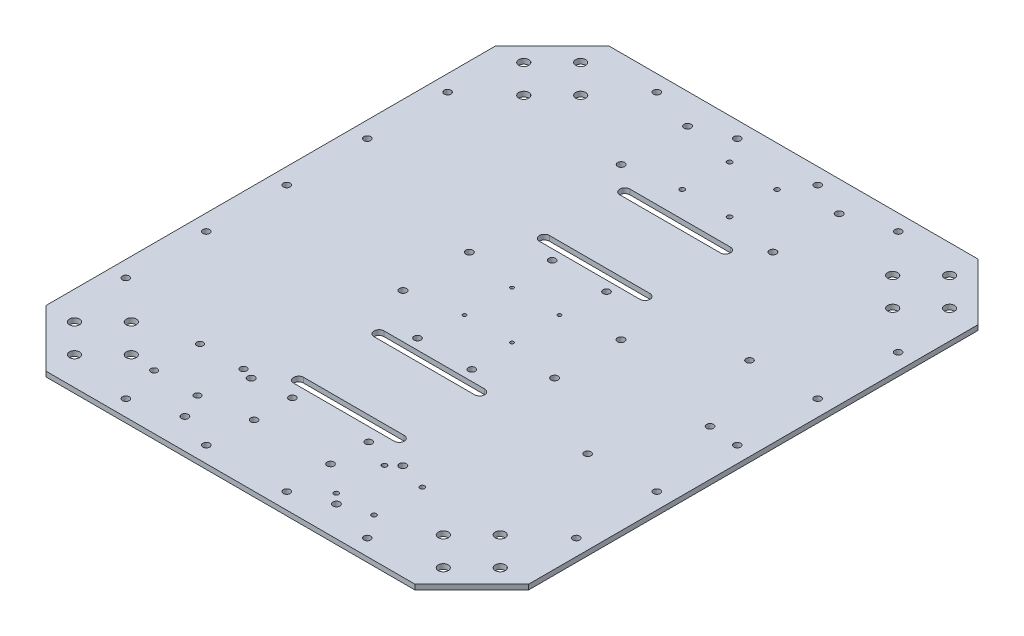
from build123d import *

# Parameters (mm, degrees)
SKETCH1_R               = 2.2225
BOSS_EXTRUDE1_DEPTH     = 3.175
SKETCH2_R               = 2.159
CUT_EXTRUDE1_DEPTH      = 297.247830215
CUT_EXTRUDE2_DEPTH      = 297.247830215
SKETCH7_R               = 1.524
CUT_EXTRUDE3_DEPTH      = 297.247830215
CUT_EXTRUDE4_DEPTH      = 297.247830215
CUT_EXTRUDE4_DEPTH_BACK = 297.247830215
SKETCH8_R               = 1.524
SKETCH9_R               = 2.032
CUT_EXTRUDE5_DEPTH      = 297.247830215
SKETCH10_R              = 2.159
CUT_EXTRUDE6_DEPTH      = 297.247830215
SKETCH13_R              = 1.1
CUT_EXTRUDE8_DEPTH      = 297.247830215
SKETCH14_R              = 3.175
CUT_EXTRUDE9_DEPTH      = 297.247830215
SKETCH15_R              = 2.159
CUT_EXTRUDE10_DEPTH     = 297.247830215
SKETCH16_R              = 2.159
CUT_EXTRUDE11_DEPTH     = 297.247830215


with BuildPart() as part:
    # Sketch1 → Boss-Extrude1 (new body)
    with BuildSketch(Plane(origin=(0, 0, 0), x_dir=(1, 0, 0), z_dir=(0, 1, 0))):
        Polygon((-85.365028143, 123.058976948), (-121.286052627, 87.137952464), (-121.286052627, -196.619998567), (-85.365028143, -232.541023052), (147.592922888, -232.541023052), (183.513947373, -196.619998567), (183.513947373, 87.137952464), (147.592922888, 123.058976948), align=None)
        with Locations(Location((-16.765052627, -213.491023052, 0), (0, 0, 270))):
            Circle(SKETCH1_R, mode=Mode.SUBTRACT)
        with Locations(Location((-16.765052627, -171.581023052, 0), (0, 0, 270))):
            Circle(SKETCH1_R, mode=Mode.SUBTRACT)
        with Locations(Location((-16.765052627, -75.696023052, 0), (0, 0, 270))):
            Circle(SKETCH1_R, mode=Mode.SUBTRACT)
        with Locations(Location((78.992947373, -213.491023052, 0), (0, 0, 270))):
            Circle(SKETCH1_R, mode=Mode.SUBTRACT)
        with Locations(Location((78.992947373, -171.581023052, 0), (0, 0, 270))):
            Circle(SKETCH1_R, mode=Mode.SUBTRACT)
        with Locations(Location((78.992947373, -75.696023052, 0), (0, 0, 270))):
            Circle(SKETCH1_R, mode=Mode.SUBTRACT)
        with Locations(Location((-16.765052627, -33.786023052, 0), (0, 0, 270))):
            Circle(SKETCH1_R, mode=Mode.SUBTRACT)
        with Locations(Location((-16.765052627, 62.098976948, 0), (0, 0, 270))):
            Circle(SKETCH1_R, mode=Mode.SUBTRACT)
        with Locations(Location((-16.765052627, 104.008976948, 0), (0, 0, 270))):
            Circle(SKETCH1_R, mode=Mode.SUBTRACT)
        with Locations(Location((78.992947373, -33.786023052, 0), (0, 0, 270))):
            Circle(SKETCH1_R, mode=Mode.SUBTRACT)
        with Locations(Location((78.992947373, 62.098976948, 0), (0, 0, 270))):
            Circle(SKETCH1_R, mode=Mode.SUBTRACT)
        with Locations(Location((78.992947373, 104.008976948, 0), (0, 0, 270))):
            Circle(SKETCH1_R, mode=Mode.SUBTRACT)
    extrude(amount=BOSS_EXTRUDE1_DEPTH)

    # Sketch2 → Cut-Extrude1 (cut, through all)
    with BuildSketch(Plane(origin=(0, 3.175, 0), x_dir=(1, 0, 0), z_dir=(0, 1, 0))):
        with Locations(Location((13.841947373, -12.069023052, 0), (0, 0, 270))):
            Circle(SKETCH2_R)
        with Locations(Location((48.131947373, -12.069023052, 0), (0, 0, 270))):
            Circle(SKETCH2_R)
        with Locations(Location((13.841947373, -97.159023052, 0), (0, 0, 270))):
            Circle(SKETCH2_R)
        with Locations(Location((48.131947373, -97.159023052, 0), (0, 0, 270))):
            Circle(SKETCH2_R)
    extrude(amount=-CUT_EXTRUDE1_DEPTH, mode=Mode.SUBTRACT)

    # Sketch4 → Cut-Extrude2 (cut, through all)
    with BuildSketch(Plane(origin=(0, 3.175, 0), x_dir=(1, 0, 0), z_dir=(0, 1, 0))):
        with BuildLine():
            Line((-0.636052627, 51.430976948), (62.863947373, 51.430976948))
            ThreePointArc((62.863947373, 51.430976948), (66.038947373, 48.255976948), (62.863947373, 45.080976948))
            Line((62.863947373, 45.080976948), (-0.636052627, 45.080976948))
            ThreePointArc((-0.636052627, 45.080976948), (-3.811052627, 48.255976948), (-0.636052627, 51.430976948))
        make_face()
        with BuildLine():
            Line((-0.636052627, 0.630976948), (62.863947373, 0.630976948))
            ThreePointArc((62.863947373, 0.630976948), (66.038947373, -2.544023052), (62.863947373, -5.719023052))
            Line((62.863947373, -5.719023052), (-0.636052627, -5.719023052))
            ThreePointArc((-0.636052627, -5.719023052), (-3.811052627, -2.544023052), (-0.636052627, 0.630976948))
        make_face()
        with BuildLine():
            Line((-0.636052627, -110.113023052), (62.863947373, -110.113023052))
            ThreePointArc((62.863947373, -110.113023052), (66.038947373, -106.938023052), (62.863947373, -103.763023052))
            Line((62.863947373, -103.763023052), (-0.636052627, -103.763023052))
            ThreePointArc((-0.636052627, -103.763023052), (-3.811052627, -106.938023052), (-0.636052627, -110.113023052))
        make_face()
        with BuildLine():
            Line((-0.636052627, -160.913023052), (62.863947373, -160.913023052))
            ThreePointArc((62.863947373, -160.913023052), (66.038947373, -157.738023052), (62.863947373, -154.563023052))
            Line((62.863947373, -154.563023052), (-0.636052627, -154.563023052))
            ThreePointArc((-0.636052627, -154.563023052), (-3.811052627, -157.738023052), (-0.636052627, -160.913023052))
        make_face()
    extrude(amount=-CUT_EXTRUDE2_DEPTH, mode=Mode.SUBTRACT)

    # Sketch7 → Cut-Extrude3 (cut, through all)
    with BuildSketch(Plane(origin=(0, 3.175, 0), x_dir=(1, 0, 0), z_dir=(0, 1, 0))):
        with Locations(Location((16.127947373, 67.686976948, 0), (0, 0, 270))):
            Circle(SKETCH7_R)
        with Locations(Location((46.099947373, 67.686976948, 0), (0, 0, 270))):
            Circle(SKETCH7_R)
        with Locations(Location((16.127947373, 97.658976948, 0), (0, 0, 270))):
            Circle(SKETCH7_R)
        with Locations(Location((46.099947373, 97.658976948, 0), (0, 0, 270))):
            Circle(SKETCH7_R)
    extrude(amount=-CUT_EXTRUDE3_DEPTH, mode=Mode.SUBTRACT)

    # Sketch8 → Cut-Extrude4 (cut, two sides: drawn at the far end of the back side and taken through both)
    with BuildSketch(Plane(origin=(0, 3.175, 0), x_dir=(1, 0, 0), z_dir=(0, 1, 0)).offset(-CUT_EXTRUDE4_DEPTH_BACK)):
        with Locations(Location((73.023947373, -207.649023052, 0), (0, 0, 270))):
            Circle(SKETCH8_R)
        with Locations(Location((73.023947373, -177.169023052, 0), (0, 0, 270))):
            Circle(SKETCH8_R)
        with Locations(Location((96.899947373, -207.649023052, 0), (0, 0, 270))):
            Circle(SKETCH8_R)
        with Locations(Location((96.899947373, -177.169023052, 0), (0, 0, 270))):
            Circle(SKETCH8_R)
    extrude(amount=CUT_EXTRUDE4_DEPTH + CUT_EXTRUDE4_DEPTH_BACK, mode=Mode.SUBTRACT)

    # Sketch9 → Cut-Extrude5 (cut, through all)
    with BuildSketch(Plane(origin=(0, 0, 0), x_dir=(-1, 0, 0), z_dir=(0, -1, 0))):
        with Locations(Location((51.649412627, -197.969083052, 0), (0, 0, 90))):
            Circle(SKETCH9_R)
        with Locations(Location((24.217412627, -197.969083052, 0), (0, 0, 90))):
            Circle(SKETCH9_R)
        with Locations(Location((51.649412627, -169.013083052, 0), (0, 0, 90))):
            Circle(SKETCH9_R)
        with Locations(Location((24.217412627, -169.013083052, 0), (0, 0, 90))):
            Circle(SKETCH9_R)
    extrude(amount=-CUT_EXTRUDE5_DEPTH, mode=Mode.SUBTRACT)

    # Sketch10 → Cut-Extrude6 (cut, through all)
    with BuildSketch(Plane.XZ):
        with Locations(Location((6.983947373, 193.475823052, 0), (0, 0, 270))):
            Circle(SKETCH10_R)
        with Locations(Location((55.243947373, 193.475823052, 0), (0, 0, 270))):
            Circle(SKETCH10_R)
        with Locations(Location((6.983947373, 169.345823052, 0), (0, 0, 270))):
            Circle(SKETCH10_R)
        with Locations(Location((55.243947373, 169.345823052, 0), (0, 0, 270))):
            Circle(SKETCH10_R)
    extrude(amount=-CUT_EXTRUDE6_DEPTH, mode=Mode.SUBTRACT)

    # Sketch13 → Cut-Extrude8 (cut, through all)
    with BuildSketch(Plane.XZ):
        with Locations(Location((16.113947373, 69.741023052, 0), (0, 0, 270))):
            Circle(SKETCH13_R)
        with Locations(Location((16.113947373, 39.741023052, 0), (0, 0, 270))):
            Circle(SKETCH13_R)
        with Locations(Location((46.113947373, 39.741023052, 0), (0, 0, 90))):
            Circle(SKETCH13_R)
        with Locations(Location((46.113947373, 69.741023052, 0), (0, 0, 90))):
            Circle(SKETCH13_R)
    extrude(amount=-CUT_EXTRUDE8_DEPTH, mode=Mode.SUBTRACT)

    # Sketch14 → Cut-Extrude9 (cut, through all)
    with BuildSketch(Plane.XZ):
        with Locations(Location((-103.325540385, 196.619998567, 0), (0, 0, 270))):
            Circle(SKETCH14_R)
        with Locations(Location((-85.365028143, 214.580510809, 0), (0, 0, 270))):
            Circle(SKETCH14_R)
        with Locations(Location((-85.365028143, 178.659486325, 0), (0, 0, 270))):
            Circle(SKETCH14_R)
        with Locations(Location((-67.404515901, 196.619998567, 0), (0, 0, 270))):
            Circle(SKETCH14_R)
        with Locations(Location((129.632410646, 196.619998567, 0), (0, 0, 90))):
            Circle(SKETCH14_R)
        with Locations(Location((147.592922888, 178.659486325, 0), (0, 0, 90))):
            Circle(SKETCH14_R)
        with Locations(Location((165.55343513, 196.619998567, 0), (0, 0, 90))):
            Circle(SKETCH14_R)
        with Locations(Location((147.592922888, 214.580510809, 0), (0, 0, 90))):
            Circle(SKETCH14_R)
        with Locations(Location((-85.365028143, -105.098464706, 0), (0, 0, 90))):
            Circle(SKETCH14_R)
        with Locations(Location((-103.325540385, -87.137952464, 0), (0, 0, 90))):
            Circle(SKETCH14_R)
        with Locations(Location((-85.365028143, -69.177440222, 0), (0, 0, 90))):
            Circle(SKETCH14_R)
        with Locations(Location((-67.404515901, -87.137952464, 0), (0, 0, 90))):
            Circle(SKETCH14_R)
        with Locations(Location((165.55343513, -87.137952464, 0), (0, 0, 270))):
            Circle(SKETCH14_R)
        with Locations(Location((147.592922888, -69.177440222, 0), (0, 0, 270))):
            Circle(SKETCH14_R)
        with Locations(Location((147.592922888, -105.098464706, 0), (0, 0, 270))):
            Circle(SKETCH14_R)
        with Locations(Location((129.632410646, -87.137952464, 0), (0, 0, 270))):
            Circle(SKETCH14_R)
    extrude(amount=-CUT_EXTRUDE9_DEPTH, mode=Mode.SUBTRACT)

    # Sketch15 → Cut-Extrude10 (cut, through all)
    with BuildSketch(Plane.XZ):
        with Locations(Location((5.713947373, 222.381023052, 0), (0, 0, 270))):
            Circle(SKETCH15_R)
        with Locations(Location((-45.086052627, 222.381023052, 0), (0, 0, 270))):
            Circle(SKETCH15_R)
        with Locations(Location((-111.126052627, 54.741023052, 0), (0, 0, 270))):
            Circle(SKETCH15_R)
        with Locations(Location((-111.126052627, 105.541023052, 0), (0, 0, 270))):
            Circle(SKETCH15_R)
        with Locations(Location((-111.126052627, 156.341023052, 0), (0, 0, 270))):
            Circle(SKETCH15_R)
        with Locations(Location((173.353947373, 156.341023052, 0), (0, 0, 90))):
            Circle(SKETCH15_R)
        with Locations(Location((173.353947373, 105.541023052, 0), (0, 0, 90))):
            Circle(SKETCH15_R)
        with Locations(Location((173.353947373, 54.741023052, 0), (0, 0, 90))):
            Circle(SKETCH15_R)
        with Locations(Location((107.313947373, 222.381023052, 0), (0, 0, 90))):
            Circle(SKETCH15_R)
        with Locations(Location((56.513947373, 222.381023052, 0), (0, 0, 90))):
            Circle(SKETCH15_R)
        with Locations(Location((56.513947373, -112.898976948, 0), (0, 0, 270))):
            Circle(SKETCH15_R)
        with Locations(Location((107.313947373, -112.898976948, 0), (0, 0, 270))):
            Circle(SKETCH15_R)
        with Locations(Location((173.353947373, 3.941023052, 0), (0, 0, 270))):
            Circle(SKETCH15_R)
        with Locations(Location((173.353947373, -46.858976948, 0), (0, 0, 270))):
            Circle(SKETCH15_R)
        with Locations(Location((-111.126052627, -46.858976948, 0), (0, 0, 90))):
            Circle(SKETCH15_R)
        with Locations(Location((-111.126052627, 3.941023052, 0), (0, 0, 90))):
            Circle(SKETCH15_R)
        with Locations(Location((-45.086052627, -112.898976948, 0), (0, 0, 90))):
            Circle(SKETCH15_R)
        with Locations(Location((5.713947373, -112.898976948, 0), (0, 0, 90))):
            Circle(SKETCH15_R)
    extrude(amount=-CUT_EXTRUDE10_DEPTH, mode=Mode.SUBTRACT)

    # Sketch16 → Cut-Extrude11 (cut, through all)
    with BuildSketch(Plane(origin=(0, 0, 0), x_dir=(-1, 0, 0), z_dir=(0, -1, 0))):
        with Locations(Location((-130.865574362, -106.679409794, 0), (0, 0, 90))):
            Circle(SKETCH16_R)
        with Locations(Location((-130.865574362, -4.529409794, 0), (0, 0, 90))):
            Circle(SKETCH16_R)
        with Locations(Location((-154.465574362, -53.029409794, 0), (0, 0, 90))):
            Circle(SKETCH16_R)
    extrude(amount=-CUT_EXTRUDE11_DEPTH, mode=Mode.SUBTRACT)


solid = part.part
